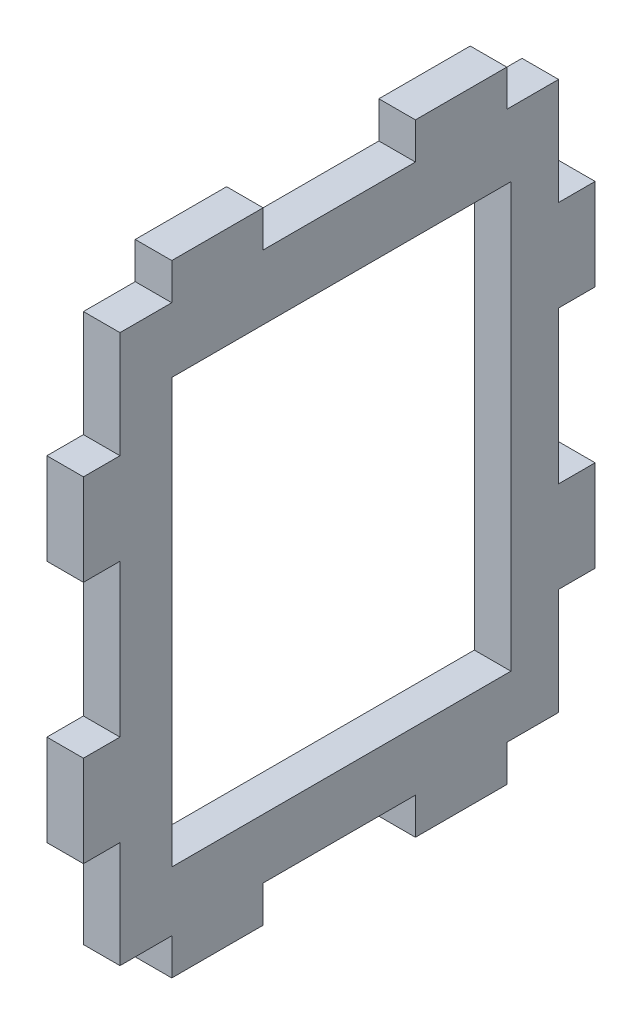
from build123d import *

# Parameters (mm, degrees)
SKETCH1_W           = 55.675357375
SKETCH1_H           = 69.594196719
BOSS_EXTRUDE1_DEPTH = 6


with BuildPart() as part:
    # Sketch1 → Boss-Extrude1 (new body)
    with BuildSketch(Plane(origin=(0, 0, 0), x_dir=(0, 0, -1), z_dir=(1, 0, 0))):
        Polygon((36, -45), (27.5, -45), (27.5, -51), (12.5, -51), (12.5, -45), (-12.5, -45), (-12.5, -51), (-27.5, -51), (-27.5, -45), (-36, -45), (-36, -27.5), (-42, -27.5), (-42, -12.5), (-36, -12.5), (-36, 12.5), (-42, 12.5), (-42, 27.5), (-36, 27.5), (-36, 45), (-27.5, 45), (-27.5, 51), (-12.5, 51), (-12.5, 45), (12.5, 45), (12.5, 51), (27.5, 51), (27.5, 45), (36, 45), (36, 27.5), (42, 27.5), (42, 12.5), (36, 12.5), (36, -12.5), (42, -12.5), (42, -27.5), (36, -27.5), align=None)
        with Locations((0.337678688, -0.42209836)):
            Rectangle(SKETCH1_W, SKETCH1_H, mode=Mode.SUBTRACT)
    extrude(amount=BOSS_EXTRUDE1_DEPTH)


solid = part.part
